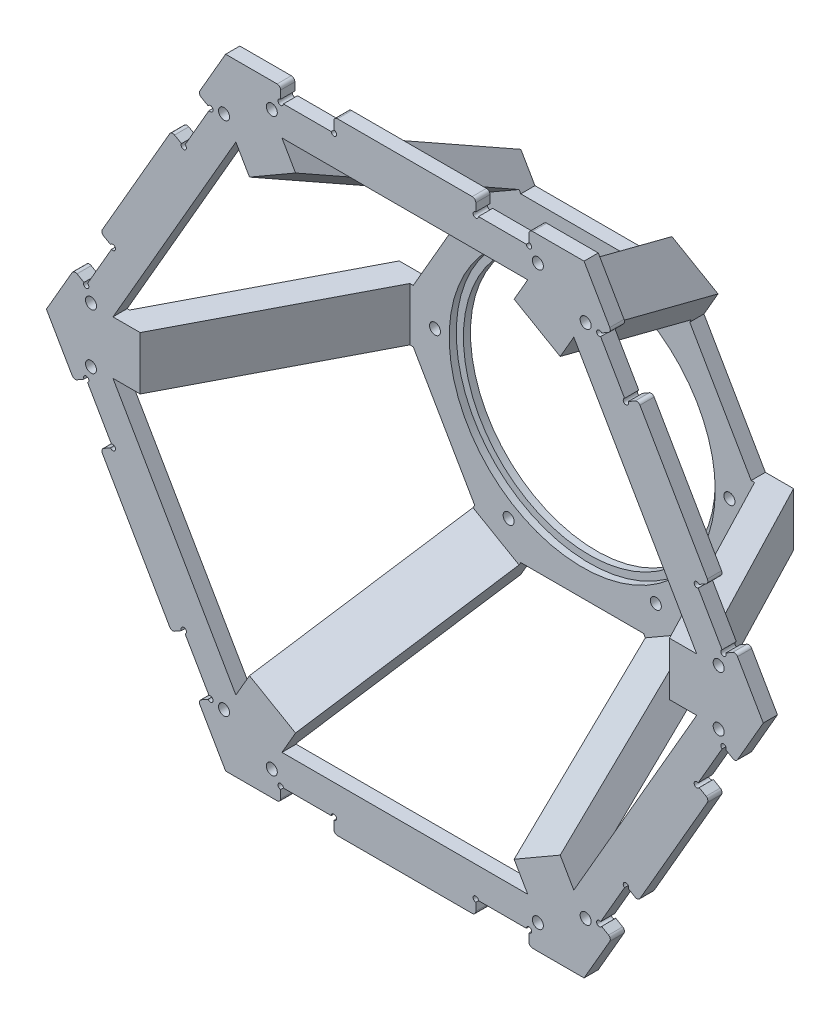
from build123d import *

# Parameters (mm, degrees)
SKETCH48_R           = 35.5
BOSS_EXTRUDE15_DEPTH = 4
SKETCH88_R           = 1.55
SKETCH88_W           = 15
SKETCH88_H           = 4
CUT_EXTRUDE1_DEPTH   = 146.170015269
SKETCH89_R           = 37.5
CUT_EXTRUDE2_DEPTH   = 2
SKETCH90_R           = 0.75
SKETCH90_R_2         = 1.55
CUT_EXTRUDE3_DEPTH   = 146.170015269
CUT_EXTRUDE5_DEPTH   = 146.170015269
CUT_EXTRUDE6_DEPTH   = 146.170015269
FILLET1_R            = 1
SKETCH93_R           = 1.55
BOSS_EXTRUDE16_DEPTH = 4
SKETCH94_R           = 133.013752104
CUT_EXTRUDE8_DEPTH   = 15
BOSS_EXTRUDE18_DEPTH = 7.5
CIRPATTERN1_COUNT    = 6


with BuildPart() as part:
    # Sketch48 → Boss-Extrude15 (new body)
    with BuildSketch(Plane.XY):
        Polygon((109.696551146, 0), (54.848275573, 95), (-54.848275573, 95), (-109.696551146, 0), (-54.848275573, -95), (54.848275573, -95), align=None)
        Circle(SKETCH48_R, mode=Mode.SUBTRACT)
    extrude(amount=BOSS_EXTRUDE15_DEPTH)

    # Sketch88 → Cut-Extrude1 (cut, through all)
    with BuildSketch(Plane.XY.offset(4)):
        with Locations((-37.5, 80.5)):
            Circle(SKETCH88_R)
        with Locations(Location((37.5, 80.5, 0), (0, 0, 180))):
            Circle(SKETCH88_R)
        with Locations((50.965045005, 72.725952642)):
            Circle(SKETCH88_R)
        with Locations(Location((88.465045005, 7.774047358, 0), (0, 0, 180))):
            Circle(SKETCH88_R)
        with Locations((88.465045005, -7.774047358)):
            Circle(SKETCH88_R)
        with Locations(Location((50.965045005, -72.725952642, 0), (0, 0, 180))):
            Circle(SKETCH88_R)
        with Locations((37.5, -80.5)):
            Circle(SKETCH88_R)
        with Locations(Location((-37.5, -80.5, 0), (0, 0, 180))):
            Circle(SKETCH88_R)
        with Locations((-50.965045005, -72.725952642)):
            Circle(SKETCH88_R)
        with Locations(Location((-88.465045005, -7.774047358, 0), (0, 0, 180))):
            Circle(SKETCH88_R)
        with Locations((-88.465045005, 7.774047358)):
            Circle(SKETCH88_R)
        with Locations(Location((-50.965045005, 72.725952642, 0), (0, 0, 180))):
            Circle(SKETCH88_R)
        with Locations((27.5, 85.5)):
            Rectangle(SKETCH88_W, SKETCH88_H)
        with Locations((-27.5, 85.5)):
            Rectangle(SKETCH88_W, SKETCH88_H)
        Polygon((58.277222831, 74.060889132), (54.813121216, 72.060889132), (62.313121216, 59.070508076), (65.777222831, 61.070508076), align=None)
        Polygon((85.777222831, 26.429491924), (82.313121216, 24.429491924), (89.813121216, 11.439110868), (93.277222831, 13.439110868), align=None)
        Polygon((93.277222831, -13.439110868), (89.813121216, -11.439110868), (82.313121216, -24.429491924), (85.777222831, -26.429491924), align=None)
        Polygon((65.777222831, -61.070508076), (62.313121216, -59.070508076), (54.813121216, -72.060889132), (58.277222831, -74.060889132), align=None)
        with Locations((27.5, -85.5)):
            Rectangle(SKETCH88_W, SKETCH88_H)
        with Locations((-27.5, -85.5)):
            Rectangle(SKETCH88_W, SKETCH88_H)
        Polygon((-58.277222831, -74.060889132), (-54.813121216, -72.060889132), (-62.313121216, -59.070508076), (-65.777222831, -61.070508076), align=None)
        Polygon((-85.777222831, -26.429491924), (-82.313121216, -24.429491924), (-89.813121216, -11.439110868), (-93.277222831, -13.439110868), align=None)
        Polygon((-93.277222831, 13.439110868), (-89.813121216, 11.439110868), (-82.313121216, 24.429491924), (-85.777222831, 26.429491924), align=None)
        Polygon((-65.777222831, 61.070508076), (-62.313121216, 59.070508076), (-54.813121216, 72.060889132), (-58.277222831, 74.060889132), align=None)
    extrude(amount=-CUT_EXTRUDE1_DEPTH, mode=Mode.SUBTRACT)

    # Sketch89 → Cut-Extrude2 (cut)
    with BuildSketch(Plane.XY.offset(4)):
        Circle(SKETCH89_R)
    extrude(amount=-CUT_EXTRUDE2_DEPTH, mode=Mode.SUBTRACT)

    # Sketch90 → Cut-Extrude3 (cut, through all)
    with BuildSketch(Plane.XY.offset(4)):
        with Locations((-35, 83.5)):
            Circle(SKETCH90_R)
        with Locations((-20, 83.5)):
            Circle(SKETCH90_R)
        with Locations((20, 83.5)):
            Circle(SKETCH90_R)
        with Locations((35, 83.5)):
            Circle(SKETCH90_R)
        with Locations((54.813121216, 72.060889132)):
            Circle(SKETCH90_R)
        with Locations((62.313121216, 59.070508076)):
            Circle(SKETCH90_R)
        with Locations((82.313121216, 24.429491924)):
            Circle(SKETCH90_R)
        with Locations((89.813121216, 11.439110868)):
            Circle(SKETCH90_R)
        with Locations((89.813121216, -11.439110868)):
            Circle(SKETCH90_R)
        with Locations((82.313121216, -24.429491924)):
            Circle(SKETCH90_R)
        with Locations((62.313121216, -59.070508076)):
            Circle(SKETCH90_R)
        with Locations((54.813121216, -72.060889132)):
            Circle(SKETCH90_R)
        with Locations((35, -83.5)):
            Circle(SKETCH90_R)
        with Locations((20, -83.5)):
            Circle(SKETCH90_R)
        with Locations((-20, -83.5)):
            Circle(SKETCH90_R)
        with Locations((-35, -83.5)):
            Circle(SKETCH90_R)
        with Locations((-54.813121216, -72.060889132)):
            Circle(SKETCH90_R)
        with Locations((-62.313121216, -59.070508076)):
            Circle(SKETCH90_R)
        with Locations((-82.313121216, -24.429491924)):
            Circle(SKETCH90_R)
        with Locations((-89.813121216, -11.439110868)):
            Circle(SKETCH90_R)
        with Locations((-89.813121216, 11.439110868)):
            Circle(SKETCH90_R)
        with Locations((-82.313121216, 24.429491924)):
            Circle(SKETCH90_R)
        with Locations((-62.313121216, 59.070508076)):
            Circle(SKETCH90_R)
        with Locations((-54.813121216, 72.060889132)):
            Circle(SKETCH90_R)
        with Locations((41.5, 0)):
            Circle(SKETCH90_R_2)
        with Locations((20.75, -35.940054257)):
            Circle(SKETCH90_R_2)
        with Locations((-20.75, -35.940054257)):
            Circle(SKETCH90_R_2)
        with Locations((-41.5, 0)):
            Circle(SKETCH90_R_2)
        with Locations((-20.75, 35.940054257)):
            Circle(SKETCH90_R_2)
        with Locations((20.75, 35.940054257)):
            Circle(SKETCH90_R_2)
    extrude(amount=-CUT_EXTRUDE3_DEPTH, mode=Mode.SUBTRACT)

    # Sketch91 → Cut-Extrude5 (cut, through all)
    with BuildSketch(Plane.XY.offset(4)):
        with BuildLine():
            Line((30.310889132, 42.5), (41.857894516, 62.5))
            ThreePointArc((41.857894516, 62.5), (46.188021535, 65), (50.518148554, 62.5))
            Line((50.518148554, 62.5), (79.385662014, 12.5))
            ThreePointArc((79.385662014, 12.5), (79.385662014, 7.5), (75.055534995, 5))
            Line((75.055534995, 5), (51.961524227, 5))
            ThreePointArc((51.961524227, 5), (49.461524227, 5.669872981), (47.631397208, 7.5))
            Line((47.631397208, 7.5), (30.310889132, 37.5))
            ThreePointArc((30.310889132, 37.5), (29.641016151, 40), (30.310889132, 42.5))
        make_face()
        with BuildLine():
            Line((21.650635095, 47.5), (33.197640478, 67.5))
            ThreePointArc((33.197640478, 67.5), (33.197640478, 72.5), (28.867513459, 75))
            Line((28.867513459, 75), (-28.867513459, 75))
            ThreePointArc((-28.867513459, 75), (-33.197640478, 72.5), (-33.197640478, 67.5))
            Line((-33.197640478, 67.5), (-21.650635095, 47.5))
            ThreePointArc((-21.650635095, 47.5), (-19.820508076, 45.669872981), (-17.320508076, 45))
            Line((-17.320508076, 45), (17.320508076, 45))
            ThreePointArc((17.320508076, 45), (19.820508076, 45.669872981), (21.650635095, 47.5))
        make_face()
        with BuildLine():
            Line((51.961524227, -5), (75.055534995, -5))
            ThreePointArc((75.055534995, -5), (79.385662014, -7.5), (79.385662014, -12.5))
            Line((79.385662014, -12.5), (50.518148554, -62.5))
            ThreePointArc((50.518148554, -62.5), (46.188021535, -65), (41.857894516, -62.5))
            Line((41.857894516, -62.5), (30.310889132, -42.5))
            ThreePointArc((30.310889132, -42.5), (29.641016151, -40), (30.310889132, -37.5))
            Line((30.310889132, -37.5), (47.631397208, -7.5))
            ThreePointArc((47.631397208, -7.5), (49.461524227, -5.669872981), (51.961524227, -5))
        make_face()
        with BuildLine():
            Line((-30.310889132, 37.5), (-47.631397208, 7.5))
            ThreePointArc((-47.631397208, 7.5), (-49.461524227, 5.669872981), (-51.961524227, 5))
            Line((-51.961524227, 5), (-75.055534995, 5))
            ThreePointArc((-75.055534995, 5), (-79.385662014, 7.5), (-79.385662014, 12.5))
            Line((-79.385662014, 12.5), (-50.518148554, 62.5))
            ThreePointArc((-50.518148554, 62.5), (-46.188021535, 65), (-41.857894516, 62.5))
            Line((-41.857894516, 62.5), (-30.310889132, 42.5))
            ThreePointArc((-30.310889132, 42.5), (-29.641016151, 40), (-30.310889132, 37.5))
        make_face()
        with BuildLine():
            Line((-47.631397208, -7.5), (-30.310889132, -37.5))
            ThreePointArc((-30.310889132, -37.5), (-29.641016151, -40), (-30.310889132, -42.5))
            Line((-30.310889132, -42.5), (-41.857894516, -62.5))
            ThreePointArc((-41.857894516, -62.5), (-46.188021535, -65), (-50.518148554, -62.5))
            Line((-50.518148554, -62.5), (-79.385662014, -12.5))
            ThreePointArc((-79.385662014, -12.5), (-79.385662014, -7.5), (-75.055534995, -5))
            Line((-75.055534995, -5), (-51.961524227, -5))
            ThreePointArc((-51.961524227, -5), (-49.461524227, -5.669872981), (-47.631397208, -7.5))
        make_face()
        with BuildLine():
            Line((-17.320508076, -45), (17.320508076, -45))
            ThreePointArc((17.320508076, -45), (19.820508076, -45.669872981), (21.650635095, -47.5))
            Line((21.650635095, -47.5), (33.197640478, -67.5))
            ThreePointArc((33.197640478, -67.5), (33.197640478, -72.5), (28.867513459, -75))
            Line((28.867513459, -75), (-28.867513459, -75))
            ThreePointArc((-28.867513459, -75), (-33.197640478, -72.5), (-33.197640478, -67.5))
            Line((-33.197640478, -67.5), (-21.650635095, -47.5))
            ThreePointArc((-21.650635095, -47.5), (-19.820508076, -45.669872981), (-17.320508076, -45))
        make_face()
    extrude(amount=-CUT_EXTRUDE5_DEPTH, mode=Mode.SUBTRACT)

    # Sketch92 → Cut-Extrude6 (cut, through all)
    with BuildSketch(Plane.XY.offset(4)):
        Polygon((54.848275573, -95), (109.696551146, 0), (54.848275573, 95), (-54.848275573, 95), (-109.696551146, 0), (-54.848275573, -95), align=None)
        Polygon((50.518148554, -87.5), (101.036297108, 0), (50.518148554, 87.5), (-50.518148554, 87.5), (-101.036297108, 0), (-50.518148554, -87.5), align=None, mode=Mode.SUBTRACT)
    extrude(amount=-CUT_EXTRUDE6_DEPTH, mode=Mode.SUBTRACT)

    # Fillet1
    fillet1_edges = [part.edges().sort_by_distance(p)[0] for p in [
        (-65.777222831, 61.070508076, 2),
        (-58.277222831, 74.060889132, 2),
        (-58.277222831, -74.060889132, 2),
        (-65.777222831, -61.070508076, 2),
        (-85.777222831, -26.429491924, 2),
        (-93.277222831, -13.439110868, 2),
        (35, -87.5, 2),
        (20, -87.5, 2),
        (-20, -87.5, 2),
        (-35, -87.5, 2),
        (93.277222831, -13.439110868, 2),
        (85.777222831, -26.429491924, 2),
        (65.777222831, -61.070508076, 2),
        (58.277222831, -74.060889132, 2),
        (58.277222831, 74.060889132, 2),
        (65.777222831, 61.070508076, 2),
        (85.777222831, 26.429491924, 2),
        (93.277222831, 13.439110868, 2),
        (-35, 87.5, 2),
        (-20, 87.5, 2),
        (20, 87.5, 2),
        (35, 87.5, 2),
        (-93.277222831, 13.439110868, 2),
        (-85.777222831, 26.429491924, 2),
    ]]
    fillet(fillet1_edges, radius=FILLET1_R)

    # Sketch94 → Cut-Extrude8 (cut)
    with BuildSketch(Plane.XY.offset(4)):
        Circle(SKETCH94_R)
        Polygon((-25.980762114, 45), (-51.961524227, 0), (-25.980762114, -45), (25.980762114, -45), (51.961524227, 0), (25.980762114, 45), align=None, mode=Mode.SUBTRACT)
    extrude(amount=-CUT_EXTRUDE8_DEPTH, mode=Mode.SUBTRACT)



with BuildPart() as body_2:
    # Sketch93 → Boss-Extrude16 (new body)
    with BuildSketch(Plane.XY.offset(54)):
        with BuildLine():
            Line((-90.462640269, 11.814110868), (-92.411197427, 12.939110868))
            ThreePointArc((-92.411197427, 12.939110868), (-93.170016472, 13.03901129), (-93.777222831, 12.573085464))
            Line((-93.777222831, 12.573085464), (-101.036297108, 0))
            Line((-101.036297108, 0), (-93.777222831, -12.573085464))
            ThreePointArc((-93.777222831, -12.573085464), (-93.170016472, -13.03901129), (-92.411197427, -12.939110868))
            Line((-92.411197427, -12.939110868), (-90.462640269, -11.814110868))
            ThreePointArc((-90.462640269, -11.814110868), (-89.619006932, -10.714666498), (-89.438121216, -12.08862992))
            Line((-89.438121216, -12.08862992), (-82.688121216, -23.779972871))
            ThreePointArc((-82.688121216, -23.779972871), (-81.588676846, -24.623606208), (-82.962640269, -24.804491924))
            Line((-82.962640269, -24.804491924), (-84.911197427, -25.929491924))
            ThreePointArc((-84.911197427, -25.929491924), (-85.377123254, -26.536698283), (-85.277222831, -27.295517328))
            Line((-85.277222831, -27.295517328), (-66.277222831, -60.204482672))
            ThreePointArc((-66.277222831, -60.204482672), (-65.670016472, -60.670408498), (-64.911197427, -60.570508076))
            Line((-64.911197427, -60.570508076), (-62.962640269, -59.445508076))
            ThreePointArc((-62.962640269, -59.445508076), (-62.119006932, -58.346063706), (-61.938121216, -59.720027129))
            Line((-61.938121216, -59.720027129), (-55.188121216, -71.41137008))
            ThreePointArc((-55.188121216, -71.41137008), (-54.088676846, -72.255003416), (-55.462640269, -72.435889132))
            Line((-55.462640269, -72.435889132), (-57.411197427, -73.560889132))
            ThreePointArc((-57.411197427, -73.560889132), (-57.877123254, -74.168095491), (-57.777222831, -74.926914536))
            Line((-57.777222831, -74.926914536), (-50.518148554, -87.5))
            Line((-50.518148554, -87.5), (-36, -87.5))
            ThreePointArc((-36, -87.5), (-35.292893219, -87.207106781), (-35, -86.5))
            Line((-35, -86.5), (-35, -84.25))
            ThreePointArc((-35, -84.25), (-35.530330086, -82.969669914), (-34.25, -83.5))
            Line((-34.25, -83.5), (-20.75, -83.5))
            ThreePointArc((-20.75, -83.5), (-19.469669914, -82.969669914), (-20, -84.25))
            Line((-20, -84.25), (-20, -86.5))
            ThreePointArc((-20, -86.5), (-19.707106781, -87.207106781), (-19, -87.5))
            Line((-19, -87.5), (19, -87.5))
            ThreePointArc((19, -87.5), (19.707106781, -87.207106781), (20, -86.5))
            Line((20, -86.5), (20, -84.25))
            ThreePointArc((20, -84.25), (19.469669914, -82.969669914), (20.75, -83.5))
            Line((20.75, -83.5), (34.25, -83.5))
            ThreePointArc((34.25, -83.5), (35.530330086, -82.969669914), (35, -84.25))
            Line((35, -84.25), (35, -86.5))
            ThreePointArc((35, -86.5), (35.292893219, -87.207106781), (36, -87.5))
            Line((36, -87.5), (50.518148554, -87.5))
            Line((50.518148554, -87.5), (57.777222831, -74.926914536))
            ThreePointArc((57.777222831, -74.926914536), (57.877123254, -74.168095491), (57.411197427, -73.560889132))
            Line((57.411197427, -73.560889132), (55.462640269, -72.435889132))
            ThreePointArc((55.462640269, -72.435889132), (54.088676846, -72.255003416), (55.188121216, -71.41137008))
            Line((55.188121216, -71.41137008), (61.938121216, -59.720027129))
            ThreePointArc((61.938121216, -59.720027129), (62.119006932, -58.346063706), (62.962640269, -59.445508076))
            Line((62.962640269, -59.445508076), (64.911197427, -60.570508076))
            ThreePointArc((64.911197427, -60.570508076), (65.670016472, -60.670408498), (66.277222831, -60.204482672))
            Line((66.277222831, -60.204482672), (85.277222831, -27.295517328))
            ThreePointArc((85.277222831, -27.295517328), (85.377123254, -26.536698283), (84.911197427, -25.929491924))
            Line((84.911197427, -25.929491924), (82.962640269, -24.804491924))
            ThreePointArc((82.962640269, -24.804491924), (81.588676846, -24.623606208), (82.688121216, -23.779972871))
            Line((82.688121216, -23.779972871), (89.438121216, -12.08862992))
            ThreePointArc((89.438121216, -12.08862992), (89.619006932, -10.714666498), (90.462640269, -11.814110868))
            Line((90.462640269, -11.814110868), (92.411197427, -12.939110868))
            ThreePointArc((92.411197427, -12.939110868), (93.170016472, -13.03901129), (93.777222831, -12.573085464))
            Line((93.777222831, -12.573085464), (101.036297108, 0))
            Line((101.036297108, 0), (93.777222831, 12.573085464))
            ThreePointArc((93.777222831, 12.573085464), (93.170016472, 13.03901129), (92.411197427, 12.939110868))
            Line((92.411197427, 12.939110868), (90.462640269, 11.814110868))
            ThreePointArc((90.462640269, 11.814110868), (89.619006932, 10.714666498), (89.438121216, 12.08862992))
            Line((89.438121216, 12.08862992), (82.688121216, 23.779972871))
            ThreePointArc((82.688121216, 23.779972871), (81.588676846, 24.623606208), (82.962640269, 24.804491924))
            Line((82.962640269, 24.804491924), (84.911197427, 25.929491924))
            ThreePointArc((84.911197427, 25.929491924), (85.377123254, 26.536698283), (85.277222831, 27.295517328))
            Line((85.277222831, 27.295517328), (66.277222831, 60.204482672))
            ThreePointArc((66.277222831, 60.204482672), (65.670016472, 60.670408498), (64.911197427, 60.570508076))
            Line((64.911197427, 60.570508076), (62.962640269, 59.445508076))
            ThreePointArc((62.962640269, 59.445508076), (62.119006932, 58.346063706), (61.938121216, 59.720027129))
            Line((61.938121216, 59.720027129), (55.188121216, 71.41137008))
            ThreePointArc((55.188121216, 71.41137008), (54.088676846, 72.255003416), (55.462640269, 72.435889132))
            Line((55.462640269, 72.435889132), (57.411197427, 73.560889132))
            ThreePointArc((57.411197427, 73.560889132), (57.877123254, 74.168095491), (57.777222831, 74.926914536))
            Line((57.777222831, 74.926914536), (50.518148554, 87.5))
            Line((50.518148554, 87.5), (36, 87.5))
            ThreePointArc((36, 87.5), (35.292893219, 87.207106781), (35, 86.5))
            Line((35, 86.5), (35, 84.25))
            ThreePointArc((35, 84.25), (35.530330086, 82.969669914), (34.25, 83.5))
            Line((34.25, 83.5), (20.75, 83.5))
            ThreePointArc((20.75, 83.5), (19.469669914, 82.969669914), (20, 84.25))
            Line((20, 84.25), (20, 86.5))
            ThreePointArc((20, 86.5), (19.707106781, 87.207106781), (19, 87.5))
            Line((19, 87.5), (-19, 87.5))
            ThreePointArc((-19, 87.5), (-19.707106781, 87.207106781), (-20, 86.5))
            Line((-20, 86.5), (-20, 84.25))
            ThreePointArc((-20, 84.25), (-19.469669914, 82.969669914), (-20.75, 83.5))
            Line((-20.75, 83.5), (-34.25, 83.5))
            ThreePointArc((-34.25, 83.5), (-35.530330086, 82.969669914), (-35, 84.25))
            Line((-35, 84.25), (-35, 86.5))
            ThreePointArc((-35, 86.5), (-35.292893219, 87.207106781), (-36, 87.5))
            Line((-36, 87.5), (-50.518148554, 87.5))
            Line((-50.518148554, 87.5), (-57.777222831, 74.926914536))
            ThreePointArc((-57.777222831, 74.926914536), (-57.877123254, 74.168095491), (-57.411197427, 73.560889132))
            Line((-57.411197427, 73.560889132), (-55.462640269, 72.435889132))
            ThreePointArc((-55.462640269, 72.435889132), (-54.088676846, 72.255003416), (-55.188121216, 71.41137008))
            Line((-55.188121216, 71.41137008), (-61.938121216, 59.720027129))
            ThreePointArc((-61.938121216, 59.720027129), (-62.119006932, 58.346063706), (-62.962640269, 59.445508076))
            Line((-62.962640269, 59.445508076), (-64.911197427, 60.570508076))
            ThreePointArc((-64.911197427, 60.570508076), (-65.670016472, 60.670408498), (-66.277222831, 60.204482672))
            Line((-66.277222831, 60.204482672), (-85.277222831, 27.295517328))
            ThreePointArc((-85.277222831, 27.295517328), (-85.377123254, 26.536698283), (-84.911197427, 25.929491924))
            Line((-84.911197427, 25.929491924), (-82.962640269, 24.804491924))
            ThreePointArc((-82.962640269, 24.804491924), (-81.588676846, 24.623606208), (-82.688121216, 23.779972871))
            Line((-82.688121216, 23.779972871), (-89.438121216, 12.08862992))
            ThreePointArc((-89.438121216, 12.08862992), (-89.619006932, 10.714666498), (-90.462640269, 11.814110868))
        make_face()
        with Locations((-88.465045005, 7.774047358)):
            Circle(SKETCH93_R, mode=Mode.SUBTRACT)
        with Locations((-88.465045005, -7.774047358)):
            Circle(SKETCH93_R, mode=Mode.SUBTRACT)
        with Locations((-37.5, 80.5)):
            Circle(SKETCH93_R, mode=Mode.SUBTRACT)
        with Locations((-50.965045005, 72.725952642)):
            Circle(SKETCH93_R, mode=Mode.SUBTRACT)
        with Locations((50.965045005, 72.725952642)):
            Circle(SKETCH93_R, mode=Mode.SUBTRACT)
        with Locations((37.5, 80.5)):
            Circle(SKETCH93_R, mode=Mode.SUBTRACT)
        with Locations((88.465045005, -7.774047358)):
            Circle(SKETCH93_R, mode=Mode.SUBTRACT)
        with Locations((88.465045005, 7.774047358)):
            Circle(SKETCH93_R, mode=Mode.SUBTRACT)
        with Locations((37.5, -80.5)):
            Circle(SKETCH93_R, mode=Mode.SUBTRACT)
        with Locations((50.965045005, -72.725952642)):
            Circle(SKETCH93_R, mode=Mode.SUBTRACT)
        with Locations((-50.965045005, -72.725952642)):
            Circle(SKETCH93_R, mode=Mode.SUBTRACT)
        with Locations((-37.5, -80.5)):
            Circle(SKETCH93_R, mode=Mode.SUBTRACT)
        Polygon((-43.301270189, 75), (-86.602540378, 0), (-43.301270189, -75), (43.301270189, -75), (86.602540378, 0), (43.301270189, 75), align=None, mode=Mode.SUBTRACT)
    extrude(amount=-BOSS_EXTRUDE16_DEPTH)


with BuildPart() as part_1:
    add(part.part)

    add(body_2.part)  # Boss-Extrude18 merges body 2
    # Sketch95 → Boss-Extrude18 (add, symmetric)
    with BuildSketch(Plane(origin=(0, 0, 0), x_dir=(1, 0, 0), z_dir=(0, 1, 0))):
        Polygon((-74.602540378, -54), (-48.583249334, -4), (-43.583249334, -4), (-43.583249334, 0), (-55.583249334, 0), (-81.602540378, -50), (-86.602540378, -50), (-86.602540378, -54), align=None)
    boss_extrude18 = extrude(amount=BOSS_EXTRUDE18_DEPTH, both=True)

    # CirPattern1: Boss-Extrude18 ×6 about axis
    cirpattern1_axis = Axis((0, 0, 0), (0, 0, 1))
    for i in range(1, CIRPATTERN1_COUNT):
        add(boss_extrude18.rotate(cirpattern1_axis, i * 360 / CIRPATTERN1_COUNT))


solid = part_1.part
